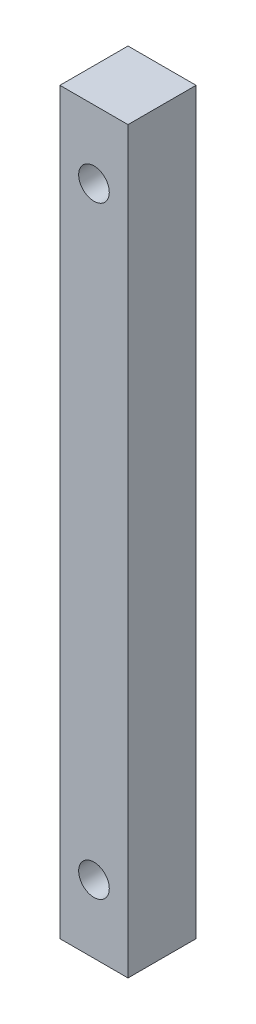
from build123d import *

# Parameters (mm, degrees)
SKETCH1_W           = 5.08
SKETCH1_H           = 55.16
SKETCH1_R           = 1.143
BOSS_EXTRUDE1_DEPTH = 5.08


with BuildPart() as part:
    # Sketch1 → Boss-Extrude1 (new body)
    with BuildSketch(Plane.XY):
        with Locations((-2.54, 11.864892086)):
            Rectangle(SKETCH1_W, SKETCH1_H)
        with Locations((-2.54, 34.364892086)):
            Circle(SKETCH1_R, mode=Mode.SUBTRACT)
        with Locations((-2.54, -10.635107914)):
            Circle(SKETCH1_R, mode=Mode.SUBTRACT)
    extrude(amount=BOSS_EXTRUDE1_DEPTH)


solid = part.part
